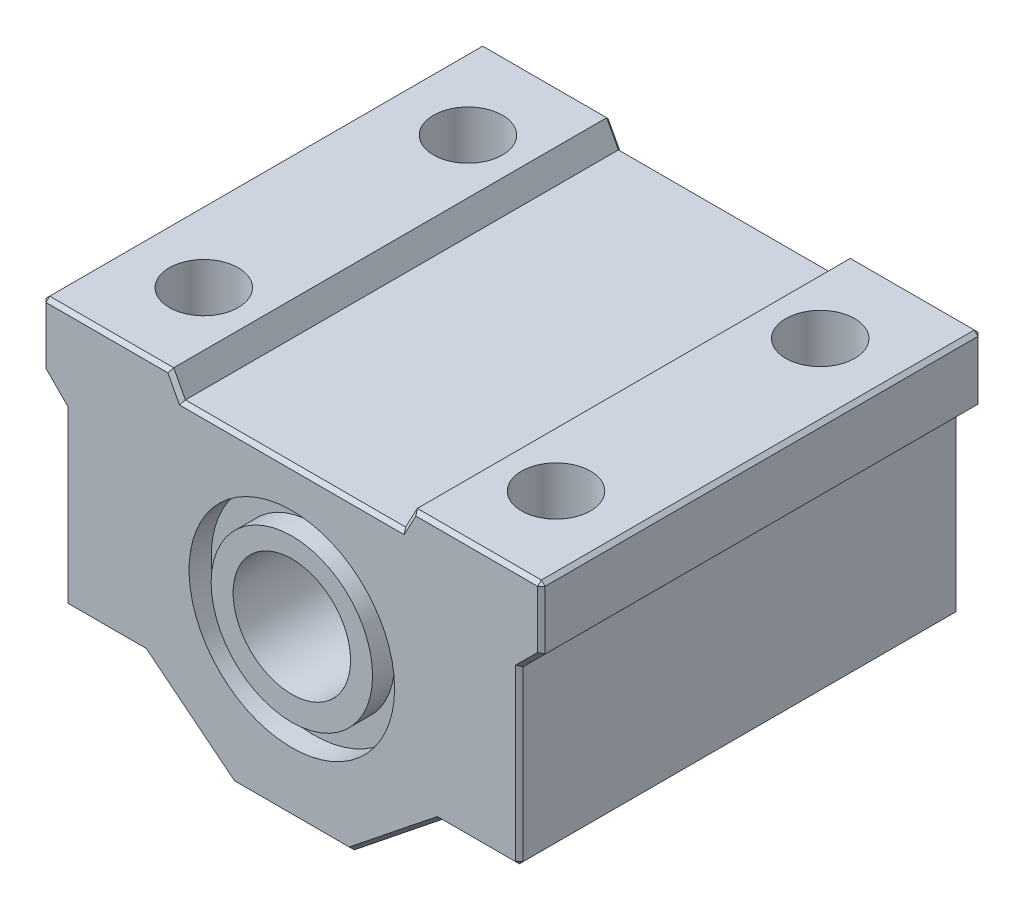
from build123d import *

# Parameters (mm, degrees)
SALIENTE_EXTRUIR1_DEPTH    = 15
CROQUIS2_R                 = 4
CORTAR_EXTRUIR1_DEPTH      = 37.239791666
CORTAR_EXTRUIR2_DEPTH      = 32.800786154
CORTAR_EXTRUIR2_DEPTH_BACK = 32.800786154
CROQUIS3_R                 = 2
SALIENTE_EXTRUIR2_DEPTH    = 30
CROQUIS5_R                 = 7
CROQUIS5_R_2               = 5.5
CORTAR_EXTRUIR3_DEPTH      = 1.5
CORTAR_EXTRUIR4_START      = -1.5
CROQUIS6_R                 = 7
CROQUIS6_R_2               = 5.5
CORTAR_EXTRUIR4_DEPTH      = 1.5
CROQUIS7_R                 = 2.35
CORTAR_EXTRUIR5_DEPTH      = 8.5
CHAFL_N1_SIZE              = 0.25


with BuildPart() as part:
    # Croquis1 → Saliente-Extruir1 (new, symmetric)
    with BuildSketch(Plane.XY):
        Polygon((-4, -11.15), (4, -11.15), (10, -6.35), (15.5, -6.35), (15.5, 5.4), (17, 6.9), (17, 11.15), (10, 11.15), (7.5, 9.65), (-7.5, 9.65), (-10, 11.15), (-17, 11.15), (-17, 6.9), (-15.5, 5.4), (-15.5, -6.35), (-10, -6.35), align=None)
    extrude(amount=SALIENTE_EXTRUIR1_DEPTH, both=True)

    # Croquis2 → Cortar-Extruir1 (cut, through all)
    with BuildSketch(Plane.XY.offset(15)):
        with Locations((0, 0.15)):
            Circle(CROQUIS2_R)
    extrude(amount=-CORTAR_EXTRUIR1_DEPTH, mode=Mode.SUBTRACT)

    # Croquis3 → Cortar-Extruir2 (cut, two sides: drawn at the far end of the back side and taken through both)
    with BuildSketch(Plane(origin=(0, 11.15, 0), x_dir=(1, 0, 0), z_dir=(0, 1, 0)).offset(-CORTAR_EXTRUIR2_DEPTH_BACK)):
        with Locations((-12, 9)):
            Circle(CROQUIS3_R)
        with Locations(Location((12, 9, 0), (0, 0, 180))):
            Circle(CROQUIS3_R)
        with Locations((-12, -9)):
            Circle(CROQUIS3_R)
        with Locations(Location((12, -9, 0), (0, 0, 180))):
            Circle(CROQUIS3_R)
    extrude(amount=CORTAR_EXTRUIR2_DEPTH + CORTAR_EXTRUIR2_DEPTH_BACK, mode=Mode.SUBTRACT)

    # Croquis4 → Saliente-Extruir2 (add, through all)
    with BuildSketch(Plane.XY.offset(15)):
        Polygon((-10, 11.15), (-7.5, 9.65), (-8.3, 11.15), align=None)
        Polygon((7.5, 9.65), (10, 11.15), (8.3, 11.15), align=None)
    extrude(amount=-SALIENTE_EXTRUIR2_DEPTH)

    # Croquis5 → Cortar-Extruir3 (cut)
    with BuildSketch(Plane.XY.offset(15)):
        Circle(CROQUIS5_R)
        Circle(CROQUIS5_R_2, mode=Mode.SUBTRACT)
    extrude(amount=-CORTAR_EXTRUIR3_DEPTH, mode=Mode.SUBTRACT)

    # Croquis6 → Cortar-Extruir4 (cut)
    with BuildSketch(Plane(origin=(0, 0, -15), x_dir=(-1, 0, 0), z_dir=(0, 0, -1)).offset(CORTAR_EXTRUIR4_START)):
        with Locations(Location((0, 0, 0), (0, 0, 180))):
            Circle(CROQUIS6_R)
        with Locations(Location((0, 0, 0), (0, 0, 180))):
            Circle(CROQUIS6_R_2, mode=Mode.SUBTRACT)
    extrude(amount=CORTAR_EXTRUIR4_DEPTH, mode=Mode.SUBTRACT)

    # Croquis7 → Cortar-Extruir5 (cut)
    with BuildSketch(Plane(origin=(0, 11.15, 0), x_dir=(1, 0, 0), z_dir=(0, 1, 0))):
        with Locations(Location((-12, 9, 0), (0, 0, 270))):
            Circle(CROQUIS7_R)
        with Locations(Location((-12, -9, 0), (0, 0, 270))):
            Circle(CROQUIS7_R)
        with Locations(Location((12, -9, 0), (0, 0, 270))):
            Circle(CROQUIS7_R)
        with Locations(Location((12, 9, 0), (0, 0, 270))):
            Circle(CROQUIS7_R)
    extrude(amount=-CORTAR_EXTRUIR5_DEPTH, mode=Mode.SUBTRACT)

    # Chaflán1
    chafl_n1_edges = [part.edges().sort_by_distance(p)[0] for p in [
        (0, 9.65, 15),
        (-7, 0, -15),
        (17, 9.025, -15),
        (16.25, 6.15, -15),
        (15.5, -0.475, -15),
        (12.75, -6.35, -15),
        (7, -8.75, -15),
        (-12.65, 11.15, 15),
        (0, -11.15, -15),
        (-7, -8.75, -15),
        (-12.75, -6.35, -15),
        (-15.5, -0.475, -15),
        (-16.25, 6.15, -15),
        (-17, 9.025, -15),
        (-12.65, 11.15, -15),
        (-17, 9.025, 15),
        (0, 9.65, -15),
        (12.65, 11.15, -15),
        (-16.25, 6.15, 15),
        (-15.5, -0.475, 15),
        (17, 11.15, 0),
        (15.5, -6.35, 0),
        (-15.5, -6.35, 0),
        (-17, 11.15, 0),
        (-12.75, -6.35, 15),
        (-7, -8.75, 15),
        (0, -11.15, 15),
        (7, -8.75, 15),
        (12.65, 11.15, 15),
        (12.75, -6.35, 15),
        (15.5, -0.475, 15),
        (16.25, 6.15, 15),
        (17, 9.025, 15),
        (-7.9, 10.4, -15),
        (-7.9, 10.4, 15),
        (7.9, 10.4, -15),
        (7.9, 10.4, 15),
    ]]
    chamfer(chafl_n1_edges, length=CHAFL_N1_SIZE)


solid = part.part
